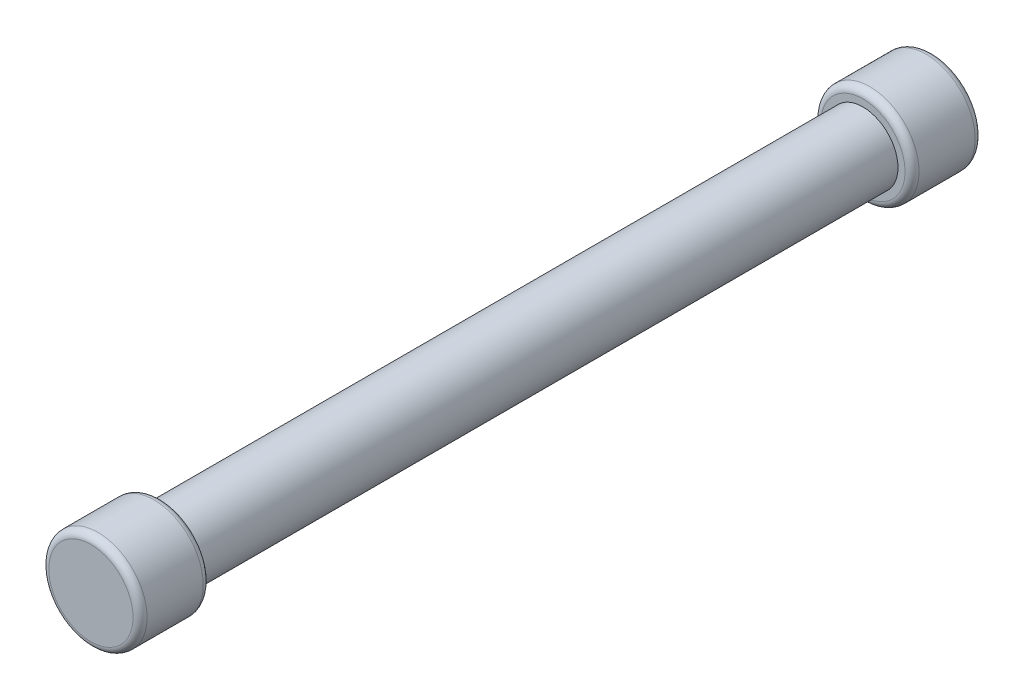
from build123d import *

# Parameters (mm, degrees)
SKETCH1_R           = 3.5
BOSS_EXTRUDE1_DEPTH = 5
SKETCH2_R           = 2.5
BOSS_EXTRUDE2_DEPTH = 50
BOSS_EXTRUDE3_START = 5
SKETCH3_R           = 3.5
BOSS_EXTRUDE3_DEPTH = 5
FILLET1_R           = 0.5


with BuildPart() as part:
    # Sketch1 → Boss-Extrude1 (new body)
    with BuildSketch(Plane.XY):
        Circle(SKETCH1_R)
    extrude(amount=BOSS_EXTRUDE1_DEPTH)

    # Sketch2 → Boss-Extrude2 (add)
    with BuildSketch(Plane(origin=(0, 0, 0), x_dir=(-1, 0, 0), z_dir=(0, 0, -1))):
        with Locations(Location((0, 0, 0), (0, 0, 180))):
            Circle(SKETCH2_R)
    extrude(amount=BOSS_EXTRUDE2_DEPTH)

    # Sketch3 → Boss-Extrude3 (add)
    with BuildSketch(Plane(origin=(0, 0, -50), x_dir=(-1, 0, 0), z_dir=(0, 0, -1)).offset(BOSS_EXTRUDE3_START)):
        with Locations(Location((0, 0, 0), (0, 0, 180))):
            Circle(SKETCH3_R)
    extrude(amount=-BOSS_EXTRUDE3_DEPTH)

    # Fillet1
    fillet1_edges = [part.edges().sort_by_distance(p)[0] for p in [
        (-3.5, 0, 0),
        (-3.5, 0, 5),
        (-3.5, 0, -50),
        (-3.5, 0, -55),
    ]]
    fillet(fillet1_edges, radius=FILLET1_R)


solid = part.part
